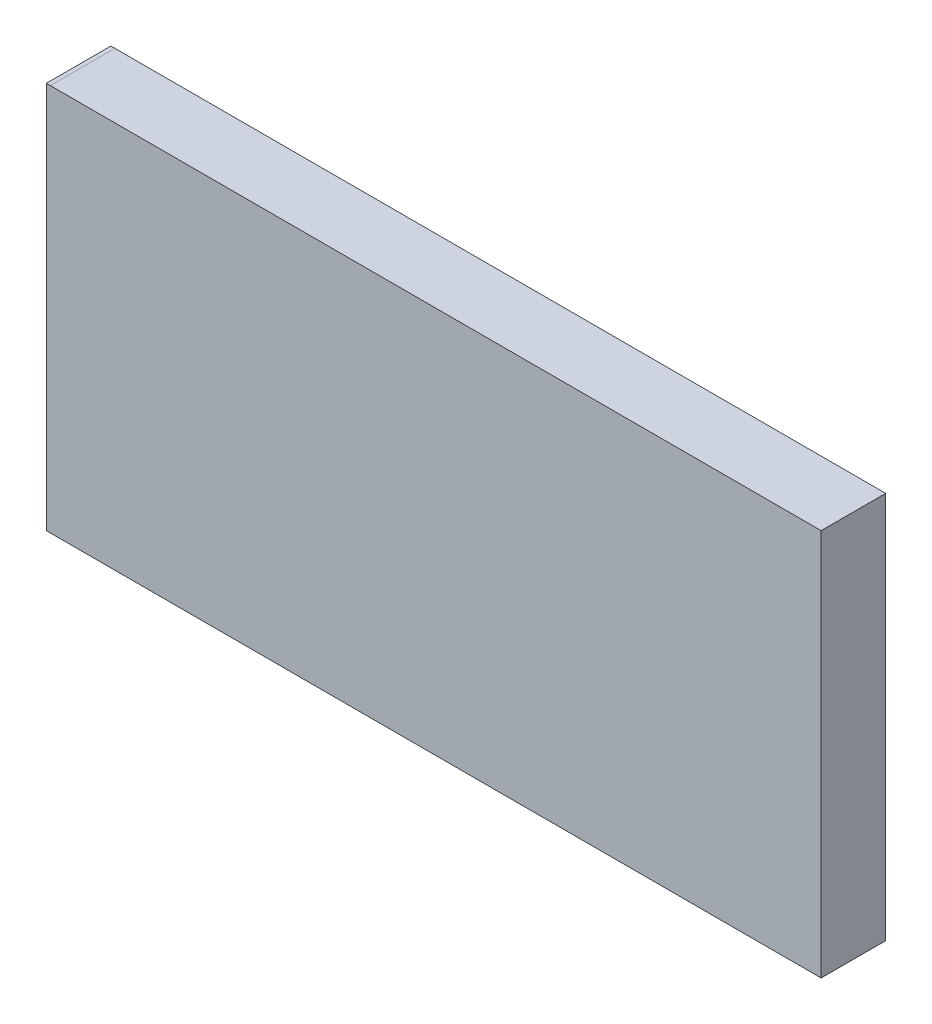
from build123d import *

# Parameters (mm, degrees)
SKETCH1_W           = 152.4
SKETCH1_H           = 76.2
BOSS_EXTRUDE1_DEPTH = 12.7


with BuildPart() as part:
    # Sketch1 → Boss-Extrude1 (new body)
    with BuildSketch(Plane.XY):
        with Locations((76.2, -38.1)):
            Rectangle(SKETCH1_W, SKETCH1_H)
    extrude(amount=BOSS_EXTRUDE1_DEPTH)


solid = part.part
